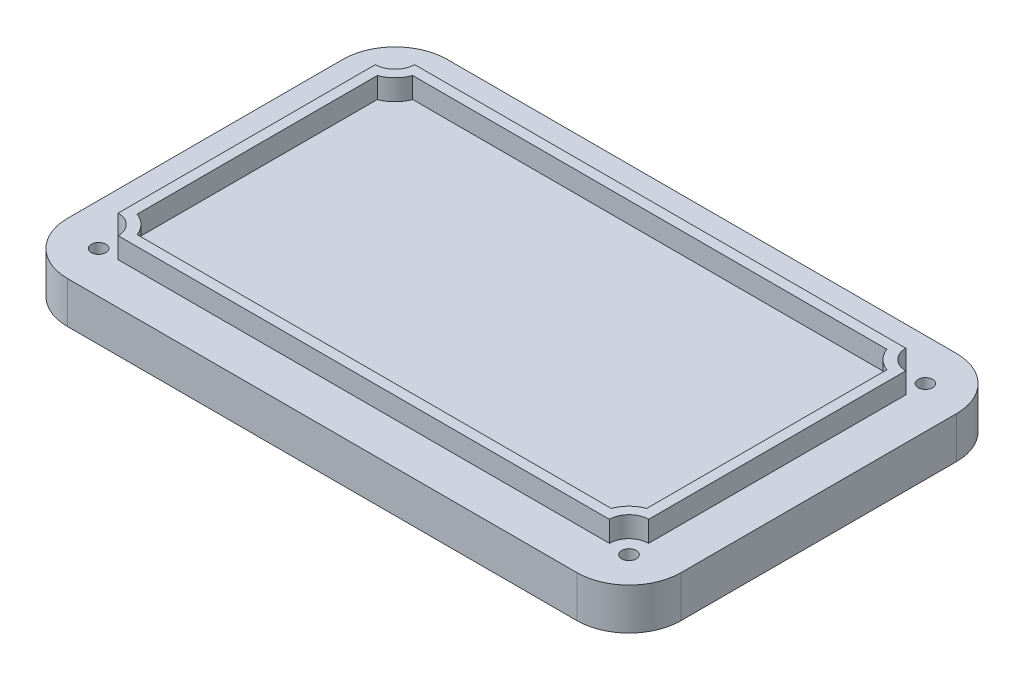
from build123d import *

# Parameters (mm, degrees)
SKETCH1_R           = 1.4
BOSS_EXTRUDE1_DEPTH = 8
BOSS_EXTRUDE2_DEPTH = 8
BOSS_EXTRUDE3_DEPTH = 4
SKETCH4_R           = 3.5
CUT_EXTRUDE1_DEPTH  = 3


with BuildPart() as part:
    # Sketch1 → Boss-Extrude1 (new body)
    with BuildSketch(Plane(origin=(0, 0, 0), x_dir=(1, 0, 0), z_dir=(0, 1, 0))):
        with BuildLine():
            ThreePointArc((-49, 36.5), (-56.071067812, 33.571067812), (-59, 26.5))
            Line((-59, 26.5), (-59, -26.5))
            ThreePointArc((-59, -26.5), (-56.071067812, -33.571067812), (-49, -36.5))
            Line((-49, -36.5), (49, -36.5))
            ThreePointArc((49, -36.5), (56.071067812, -33.571067812), (59, -26.5))
            Line((59, -26.5), (59, 26.5))
            ThreePointArc((59, 26.5), (56.071067812, 33.571067812), (49, 36.5))
            Line((49, 36.5), (-49, 36.5))
        make_face()
        with Locations(Location((-51, -28.5, 0), (0, 0, 270))):
            Circle(SKETCH1_R, mode=Mode.SUBTRACT)
        with Locations(Location((51, -28.5, 0), (0, 0, 270))):
            Circle(SKETCH1_R, mode=Mode.SUBTRACT)
        with Locations(Location((-51, 28.5, 0), (0, 0, 270))):
            Circle(SKETCH1_R, mode=Mode.SUBTRACT)
        with BuildLine():
            Line((43.828427125, -28.5), (-43.828427125, -28.5))
            Line((-43.828427125, -28.5), (-47.234932778, -28.5))
            ThreePointArc((-47.234932778, -28.5), (-48.337695436, -25.837695436), (-51, -24.734932778))
            Line((-51, -24.734932778), (-51, -21.328427125))
            Line((-51, -21.328427125), (-51, 21.328427125))
            Line((-51, 21.328427125), (-51, 24.734932778))
            ThreePointArc((-51, 24.734932778), (-48.337695436, 25.837695436), (-47.234932778, 28.5))
            Line((-47.234932778, 28.5), (-43.828427125, 28.5))
            Line((-43.828427125, 28.5), (43.828427125, 28.5))
            Line((43.828427125, 28.5), (47.234932778, 28.5))
            ThreePointArc((47.234932778, 28.5), (48.337695436, 25.837695436), (51, 24.734932778))
            Line((51, 24.734932778), (51, 21.328427125))
            Line((51, 21.328427125), (51, -21.328427125))
            Line((51, -21.328427125), (51, -24.734932778))
            ThreePointArc((51, -24.734932778), (48.337695436, -25.837695436), (47.234932778, -28.5))
            Line((47.234932778, -28.5), (43.828427125, -28.5))
        make_face(mode=Mode.SUBTRACT)
        with Locations(Location((51, 28.5, 0), (0, 0, 270))):
            Circle(SKETCH1_R, mode=Mode.SUBTRACT)
    extrude(amount=BOSS_EXTRUDE1_DEPTH)



with BuildPart() as body_2:
    # Sketch2 → Boss-Extrude2 (new body)
    with BuildSketch(Plane(origin=(0, 8, 0), x_dir=(1, 0, 0), z_dir=(0, 1, 0))):
        with BuildLine():
            Line((51, -24.734932778), (51, 24.734932778))
            ThreePointArc((51, 24.734932778), (48.337695436, 25.837695436), (47.234932778, 28.5))
            Line((47.234932778, 28.5), (-47.234932778, 28.5))
            ThreePointArc((-47.234932778, 28.5), (-48.337695436, 25.837695436), (-51, 24.734932778))
            Line((-51, 24.734932778), (-51, -24.734932778))
            ThreePointArc((-51, -24.734932778), (-48.337695436, -25.837695436), (-47.234932778, -28.5))
            Line((-47.234932778, -28.5), (47.234932778, -28.5))
            ThreePointArc((47.234932778, -28.5), (48.337695436, -25.837695436), (51, -24.734932778))
        make_face()
    extrude(amount=-BOSS_EXTRUDE2_DEPTH)


with BuildPart() as part_1:
    add(part.part)

    add(body_2.part)  # Boss-Extrude3 merges body 2
    # Sketch3 → Boss-Extrude3 (add)
    with BuildSketch(Plane(origin=(0, 8, 0), x_dir=(1, 0, 0), z_dir=(0, 1, 0))):
        with BuildLine():
            ThreePointArc((47.234932778, -28.5), (48.337695436, -25.837695436), (51, -24.734932778))
            Line((51, -24.734932778), (51, 24.734932778))
            ThreePointArc((51, 24.734932778), (48.337695436, 25.837695436), (47.234932778, 28.5))
            Line((47.234932778, 28.5), (-45.234932778, 28.5))
            Line((-45.234932778, 28.5), (-47.234932778, 28.5))
            ThreePointArc((-47.234932778, 28.5), (-48.337695436, 25.837695436), (-51, 24.734932778))
            Line((-51, 24.734932778), (-51, -24.734932778))
            ThreePointArc((-51, -24.734932778), (-48.337695436, -25.837695436), (-47.234932778, -28.5))
            Line((-47.234932778, -28.5), (47.234932778, -28.5))
        make_face()
        with BuildLine():
            ThreePointArc((-49, 23.092967535), (-46.923481873, 24.423481873), (-45.592967535, 26.5))
            Line((-45.592967535, 26.5), (45.592967535, 26.5))
            ThreePointArc((45.592967535, 26.5), (46.923481873, 24.423481873), (49, 23.092967535))
            Line((49, 23.092967535), (49, -23.092967535))
            ThreePointArc((49, -23.092967535), (46.923481873, -24.423481873), (45.592967535, -26.5))
            Line((45.592967535, -26.5), (-45.592967535, -26.5))
            ThreePointArc((-45.592967535, -26.5), (-46.923481873, -24.423481873), (-49, -23.092967535))
            Line((-49, -23.092967535), (-49, 23.092967535))
        make_face(mode=Mode.SUBTRACT)
    extrude(amount=BOSS_EXTRUDE3_DEPTH)

    # Sketch4 → Cut-Extrude1 (cut)
    with BuildSketch(Plane.XZ):
        with Locations(Location((-51, 28.5, 0), (0, 0, 270))):
            Circle(SKETCH4_R)
        with Locations(Location((51, 28.5, 0), (0, 0, 90))):
            Circle(SKETCH4_R)
        with Locations(Location((51, -28.5, 0), (0, 0, 270))):
            Circle(SKETCH4_R)
        with Locations(Location((-51, -28.5, 0), (0, 0, 90))):
            Circle(SKETCH4_R)
    extrude(amount=-CUT_EXTRUDE1_DEPTH, mode=Mode.SUBTRACT)


solid = part_1.part
